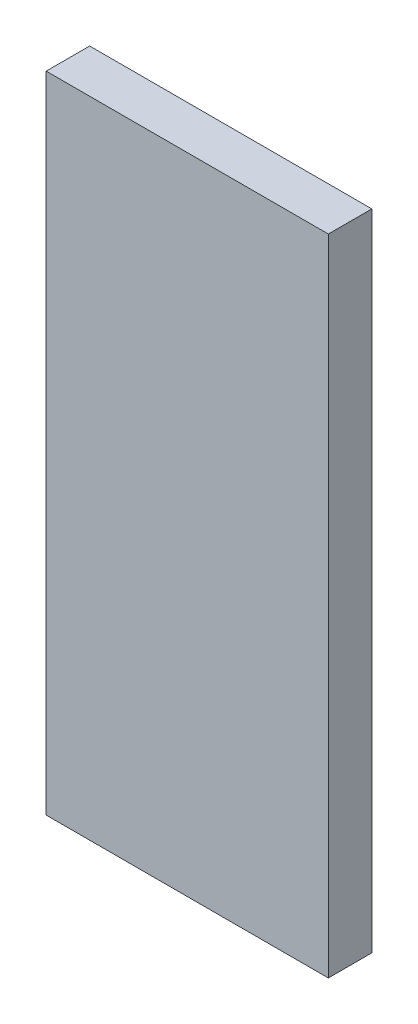
from build123d import *

# Parameters (mm, degrees)
SKETCH1_W           = 60
SKETCH1_H           = 137
BOSS_EXTRUDE1_DEPTH = 9.25


with BuildPart() as part:
    # Sketch1 → Boss-Extrude1 (new body)
    with BuildSketch(Plane.XY.offset(9.25)):
        Rectangle(SKETCH1_W, SKETCH1_H)
    extrude(amount=-BOSS_EXTRUDE1_DEPTH)


solid = part.part
